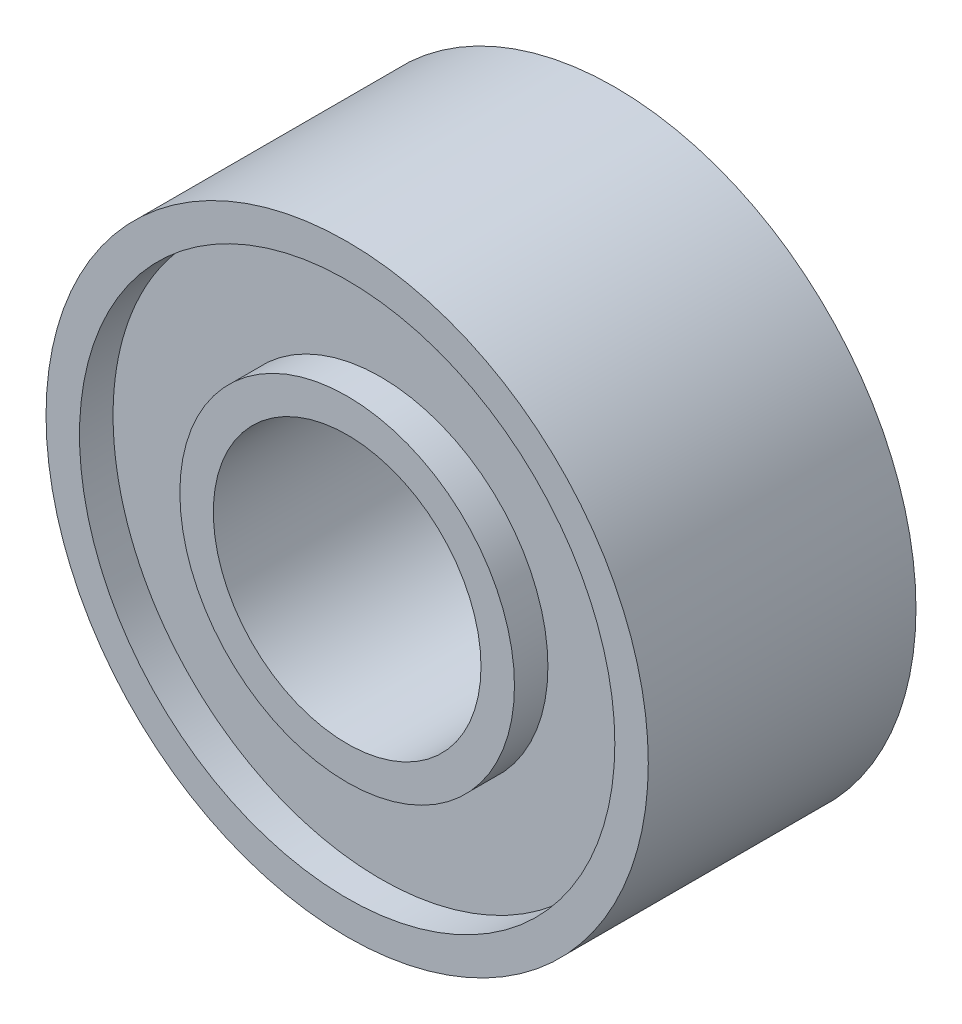
from build123d import *

# Parameters (mm, degrees)
SKETCH1_R             = 4.5
SKETCH1_R_2           = 4
BOSS_EXTRUDE1_DEPTH   = 4
SKETCH1_R_3           = 2.5
SKETCH1_R_4           = 2
BOSS_EXTRUDE1_2_DEPTH = 4
BOSS_EXTRUDE2_START   = -1.2e-05
SKETCH1_3_R           = 4
SKETCH1_3_R_2         = 2.5
BOSS_EXTRUDE2_DEPTH   = 4.000012
SKETCH2_R             = 4
SKETCH2_R_2           = 2.5
CUT_EXTRUDE3_DEPTH    = 0.5
CUT_EXTRUDE4_START    = -0.5
SKETCH3_R             = 4
SKETCH3_R_2           = 2.5
CUT_EXTRUDE4_DEPTH    = 0.5


with BuildPart() as part:
    # Sketch1 → Boss-Extrude1 (new body)
    with BuildSketch(Plane.XY):
        Circle(SKETCH1_R)
        Circle(SKETCH1_R_2, mode=Mode.SUBTRACT)
    extrude(amount=BOSS_EXTRUDE1_DEPTH)


with BuildPart() as body_2:
    # Sketch1 → Boss-Extrude1 2 (new body)
    with BuildSketch(Plane.XY):
        Circle(SKETCH1_R_3)
        Circle(SKETCH1_R_4, mode=Mode.SUBTRACT)
    extrude(amount=BOSS_EXTRUDE1_2_DEPTH)


with BuildPart() as body_3:
    # Sketch1<3> → Boss-Extrude2 (new body)
    with BuildSketch(Plane.XY.offset(BOSS_EXTRUDE2_START)):
        Circle(SKETCH1_3_R)
        Circle(SKETCH1_3_R_2, mode=Mode.SUBTRACT)
    extrude(amount=BOSS_EXTRUDE2_DEPTH)

    # Sketch2 → Cut-Extrude3 (cut)
    with BuildSketch(Plane(origin=(0, 0, -1.2e-05), x_dir=(-1, 0, 0), z_dir=(0, 0, -1))):
        Circle(SKETCH2_R)
        Circle(SKETCH2_R_2, mode=Mode.SUBTRACT)
    extrude(amount=-CUT_EXTRUDE3_DEPTH, mode=Mode.SUBTRACT)

    # Sketch3 → Cut-Extrude4 (cut)
    with BuildSketch(Plane.XY.offset(4).offset(CUT_EXTRUDE4_START)):
        with Locations(Location((0, 0, 0), (0, 0, 180))):
            Circle(SKETCH3_R)
        with Locations(Location((0, 0, 0), (0, 0, 180))):
            Circle(SKETCH3_R_2, mode=Mode.SUBTRACT)
    extrude(amount=CUT_EXTRUDE4_DEPTH, mode=Mode.SUBTRACT)


solid = Compound([part.part, body_2.part, body_3.part])
